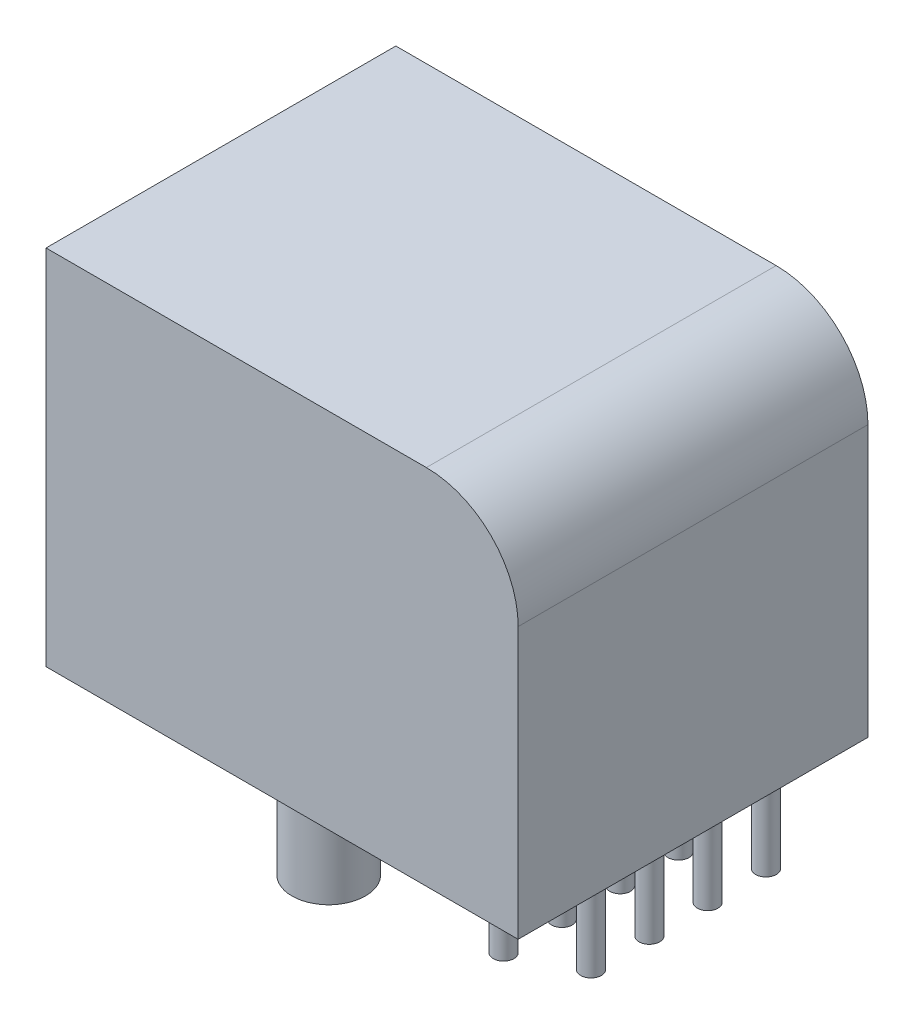
from build123d import *

# Parameters (mm, degrees)
SKETCH1_W            = 20.57
SKETCH1_H            = 15.8
BOSS_EXTRUDE1_DEPTH  = 15.24
FILLET1_R            = 4
SKETCH2_R            = 1.6
BOSS_EXTRUDE2_DEPTH  = 3.6
SKETCH2_4_R          = 0.45
BOSS_EXTRUDE3_DEPTH  = 4
SKETCH2_5_R          = 0.45
BOSS_EXTRUDE4_DEPTH  = 4
LPATTERN1_COUNT      = 3
LPATTERN1_PITCH      = 2.54
LPATTERN1_COUNT_DIR2 = 2
LPATTERN1_PITCH_DIR2 = 2.54
LPATTERN2_COUNT      = 2
LPATTERN2_PITCH      = 2.54
LPATTERN2_COUNT_DIR2 = 3
LPATTERN2_PITCH_DIR2 = 2.54


with BuildPart() as part:
    # Sketch1 → Boss-Extrude1 (new body)
    with BuildSketch(Plane.XY):
        Rectangle(SKETCH1_W, SKETCH1_H)
    extrude(amount=BOSS_EXTRUDE1_DEPTH)

    # Fillet1
    fillet1_edges = [part.edges().sort_by_distance(p)[0] for p in [
        (10.285, 7.9, 7.62),
    ]]
    fillet(fillet1_edges, radius=FILLET1_R)

    # Sketch2 → Boss-Extrude2 (add)
    with BuildSketch(Plane.XZ.offset(7.9)):
        with Locations((0.125, 13.335)):
            Circle(SKETCH2_R)
        with Locations((0.125, 1.905)):
            Circle(SKETCH2_R)
    extrude(amount=BOSS_EXTRUDE2_DEPTH)

    # Sketch2<4> → Boss-Extrude3 (add)
    with BuildSketch(Plane.XZ.offset(7.9)):
        with Locations((6.475, 6.985)):
            Circle(SKETCH2_4_R)
    boss_extrude3 = extrude(amount=BOSS_EXTRUDE3_DEPTH)

    # Sketch2<5> → Boss-Extrude4 (add)
    with BuildSketch(Plane.XZ.offset(7.9)):
        with Locations((9.015, 8.255)):
            Circle(SKETCH2_5_R)
    boss_extrude4 = extrude(amount=BOSS_EXTRUDE4_DEPTH)

    # LPattern1: Boss-Extrude4 3 × 2
    with Locations(*[Vector(0, 0, -1) * (i * LPATTERN1_PITCH) + Vector(0, 0, 1) * (j * LPATTERN1_PITCH_DIR2) for i in range(LPATTERN1_COUNT) for j in range(LPATTERN1_COUNT_DIR2) if (i, j) != (0, 0)]):
        add(boss_extrude4)

    # LPattern2: Boss-Extrude3 2 × 3
    with Locations(*[Vector(0, 0, -1) * (i * LPATTERN2_PITCH) + Vector(0, 0, 1) * (j * LPATTERN2_PITCH_DIR2) for i in range(LPATTERN2_COUNT) for j in range(LPATTERN2_COUNT_DIR2) if (i, j) != (0, 0)]):
        add(boss_extrude3)


solid = part.part
